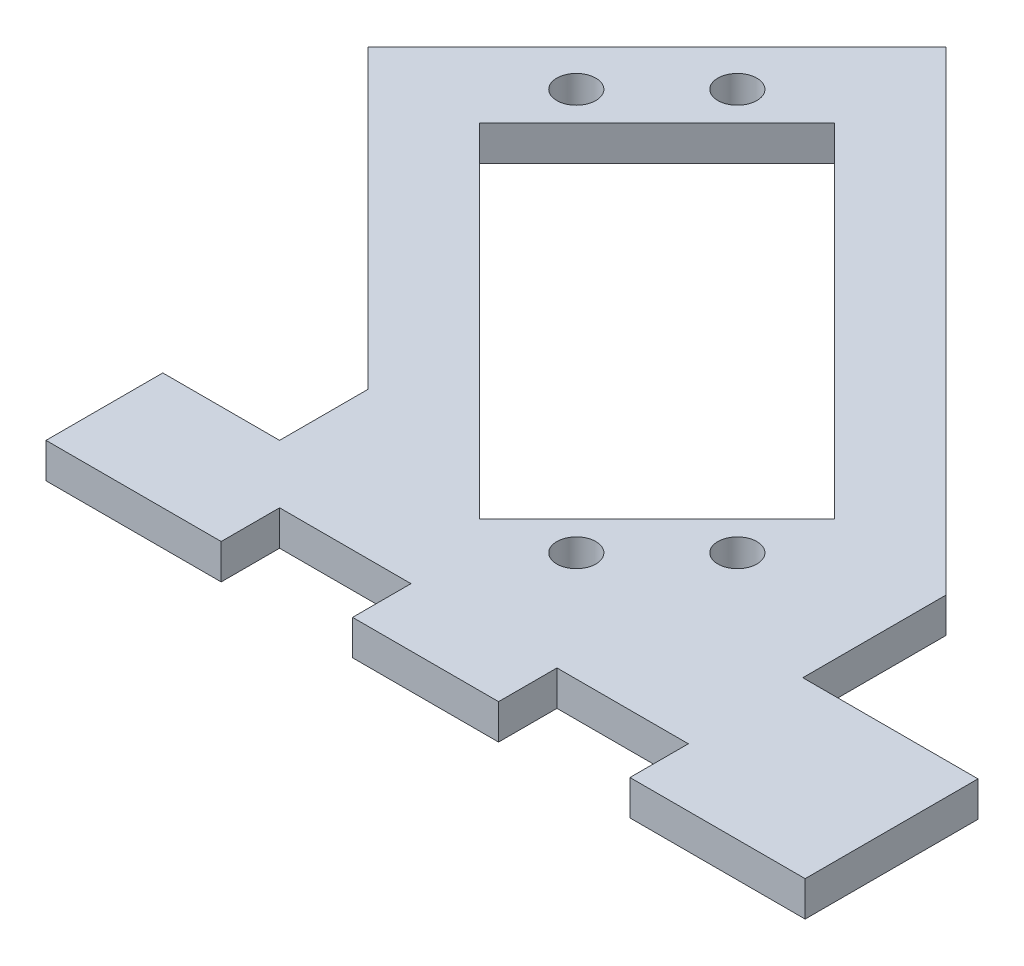
from build123d import *

# Parameters (mm, degrees)
SKETCH_1_R      = 1.670194834
EXTRUDE_1_DEPTH = 3


with BuildPart() as part:
    # 草图1 → 凸台-拉伸1 (new body)
    with BuildSketch(Plane(origin=(0, 0, 0), x_dir=(1, 0, 0), z_dir=(0, 1, 0))):
        Polygon((-14.3760191, 4.830077554), (-14.3760191, -2.722447763), (-24.3760191, -2.722447763), (-24.3760191, -12.722447763), (-9.3760191, -12.722447763), (-9.3760191, -7.722447763), (1.8739809, -7.722447763), (1.8739809, -12.722447763), (14.3739809, -12.722447763), (14.3739809, -7.722447763), (25.6239809, -7.722447763), (25.6239809, -12.722447763), (40.6239809, -12.722447763), (40.6239809, 2.077552237), (25.6239809, 2.077552237), (25.6239809, 14.327552237), (-15.0260191, 54.977552237), (-39.774756442, 30.228814896), align=None)
        with Locations(Location((-20.806617036, 42.903703948, 0), (0, 0, 270))):
            Circle(SKETCH_1_R, mode=Mode.SUBTRACT)
        with Locations(Location((-27.700908153, 36.009412832, 0), (0, 0, 90))):
            Circle(SKETCH_1_R, mode=Mode.SUBTRACT)
        with Locations(Location((6.664481413, 1.644023266, 0), (0, 0, 270))):
            Circle(SKETCH_1_R, mode=Mode.SUBTRACT)
        with Locations(Location((13.558772529, 8.538314383, 0), (0, 0, 90))):
            Circle(SKETCH_1_R, mode=Mode.SUBTRACT)
        Polygon((0, 0), (15.202795796, 15.202795796), (-14.142135624, 44.547727215), (-29.344931419, 29.344931419), align=None, mode=Mode.SUBTRACT)
    extrude(amount=EXTRUDE_1_DEPTH)


solid = part.part
